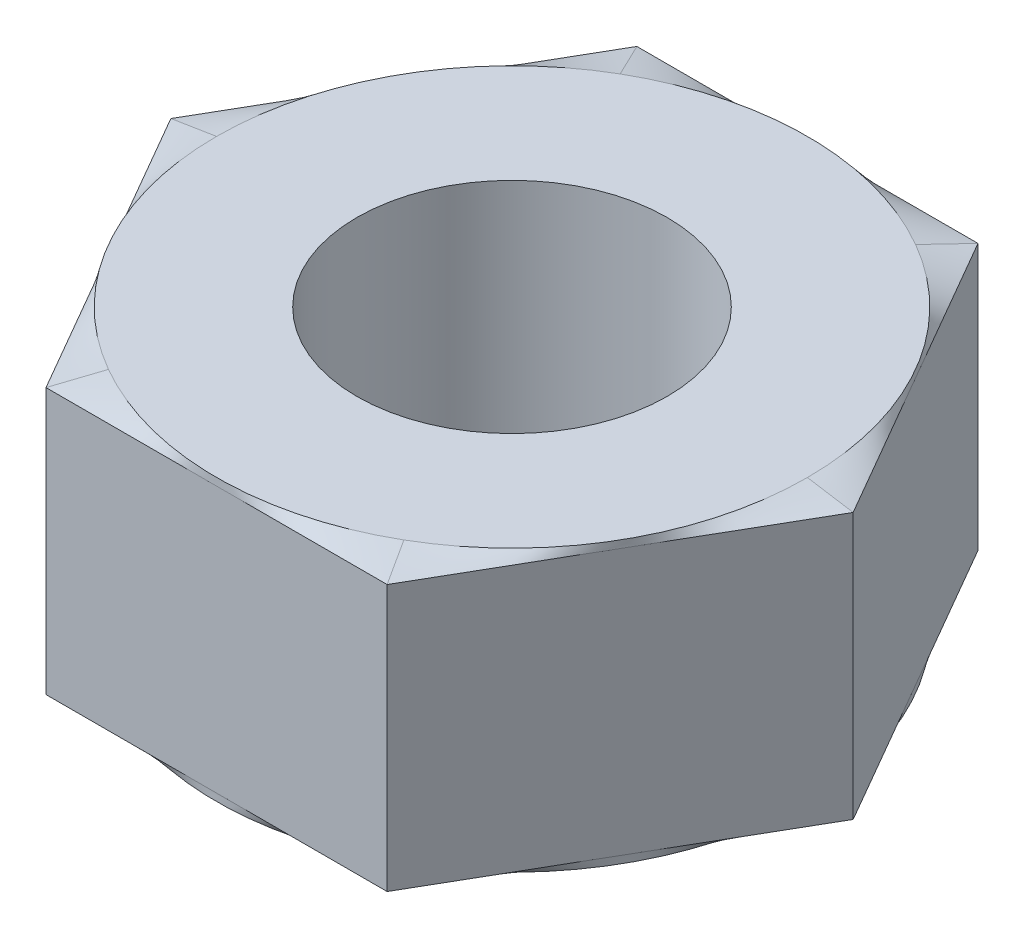
from build123d import *

# Parameters (mm, degrees)
EXTRUDE_1_DEPTH     = 1.8
SKETCH_5_R          = 2.1
CUT_EXTRUDE_1_DEPTH = 8.195369054
HOLE_WIZARD_M5_1_D  = 4.2


with BuildPart() as part:
    # 草图1 → 凸台-拉伸1 (new body)
    with BuildSketch(Plane(origin=(0, 0, 0), x_dir=(1, 0, 0), z_dir=(0, 1, 0))):
        Polygon((4.618802154, 0), (2.309401077, 4), (-2.309401077, 4), (-4.618802154, 0), (-2.309401077, -4), (2.309401077, -4), align=None)
    extrude_1 = extrude(amount=EXTRUDE_1_DEPTH)

    # 草图4 for 放样1 → 放样1 section 0
    with BuildSketch(Plane(origin=(0, -0.1, 0), x_dir=(-1, 0, 0), z_dir=(0, -1, 0))):
        with BuildLine():
            # circular arc as an exact rational Bezier (weights 1, cos(half-angle), 1)
            Bezier((-4, 0), (-4, -2.309401077), (-2, -3.464101615), weights=[1, 0.866025404, 1])
            Bezier((-2, -3.464101615), (0, -4.618802154), (2, -3.464101615), weights=[1, 0.866025404, 1])
            Bezier((2, -3.464101615), (4, -2.309401077), (4, 0), weights=[1, 0.866025404, 1])
            Bezier((4, 0), (4, 2.309401077), (2, 3.464101615), weights=[1, 0.866025404, 1])
            Bezier((2, 3.464101615), (0, 4.618802154), (-2, 3.464101615), weights=[1, 0.866025404, 1])
            Bezier((-2, 3.464101615), (-4, 2.309401077), (-4, 0), weights=[1, 0.866025404, 1])
        make_face()
    # 草图3 → 放样1 section 1
    with BuildSketch(Plane.XZ):
        with BuildLine():
            Line((4.618802154, 0), (2.309401077, 4))
            Line((2.309401077, 4), (-2.309401077, 4))
            Line((-2.309401077, 4), (-4.618802154, 0))
            Line((-4.618802154, 0), (-2.309401077, -4))
            Line((-2.309401077, -4), (2.309401077, -4))
            Line((2.309401077, -4), (4.618802154, 0))
        make_face()
    loft_1 = loft()

    # 镜向1: 凸台-拉伸1, 放样1 across plane
    add(extrude_1.mirror(Plane.ZX.offset(1.8)))
    add(loft_1.mirror(Plane.ZX.offset(1.8)))

    # 草图5 → 切除-拉伸1 (cut, through all)
    with BuildSketch(Plane(origin=(0, -0.1, 0), x_dir=(1, 0, 0), z_dir=(0, 1, 0))):
        with Locations(Location((0, 0, 0), (0, 0, 270))):
            Circle(SKETCH_5_R)
    extrude(amount=CUT_EXTRUDE_1_DEPTH, mode=Mode.SUBTRACT)

    # M5 螺纹孔1 (through all)
    with Locations(Plane.ZX.offset(3.7)):
        with Locations((0, 0)):
            Hole(HOLE_WIZARD_M5_1_D / 2)


solid = part.part
